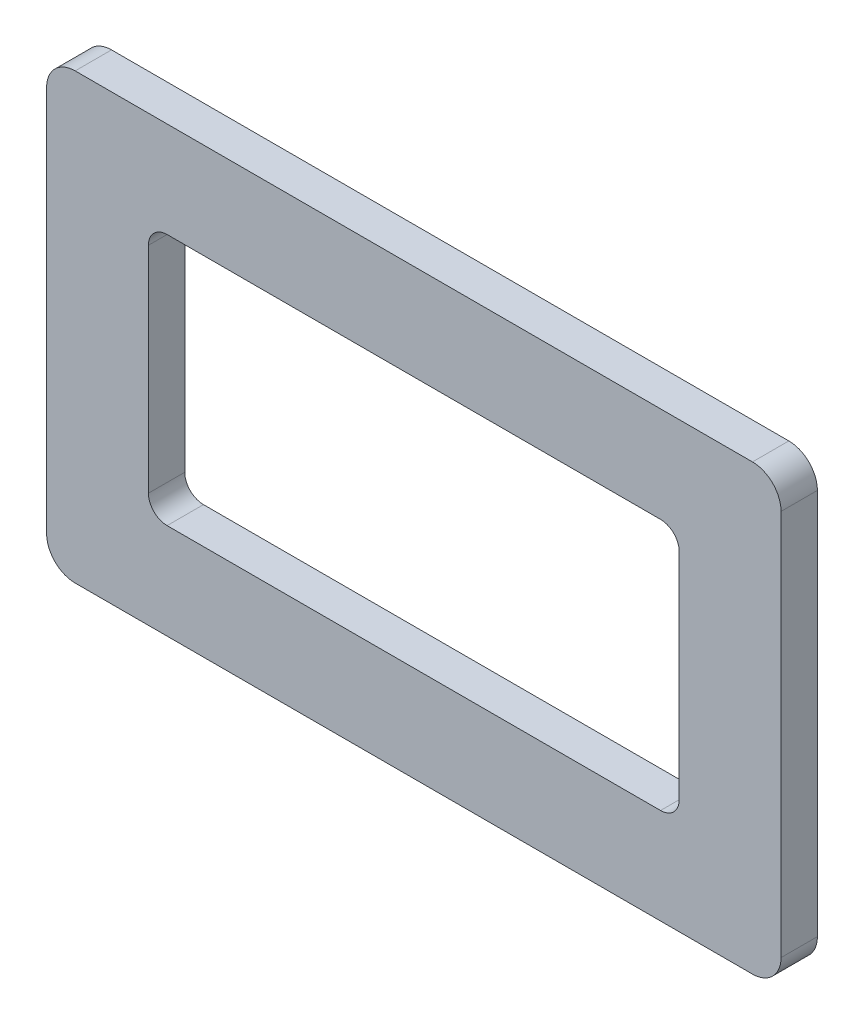
from build123d import *

# Parameters (mm, degrees)
SKETCH1_W           = 70.7
SKETCH1_H           = 42.7
SKETCH1_W_2         = 51.1
SKETCH1_H_2         = 24.268683634
BOSS_EXTRUDE1_DEPTH = 3.5
FILLET1_R           = 2.75
FILLET2_R           = 1.8


with BuildPart() as part:
    # Sketch1 → Boss-Extrude1 (new body)
    with BuildSketch(Plane.XY):
        Rectangle(SKETCH1_W, SKETCH1_H)
        Rectangle(SKETCH1_W_2, SKETCH1_H_2, mode=Mode.SUBTRACT)
    extrude(amount=BOSS_EXTRUDE1_DEPTH)

    # Fillet1
    fillet1_edges = [part.edges().sort_by_distance(p)[0] for p in [
        (35.35, -21.35, 1.75),
        (-35.35, -21.35, 1.75),
        (-35.35, 21.35, 1.75),
        (35.35, 21.35, 1.75),
    ]]
    fillet(fillet1_edges, radius=FILLET1_R)

    # Fillet2
    fillet2_edges = [part.edges().sort_by_distance(p)[0] for p in [
        (25.55, -12.134341817, 1.75),
        (25.55, 12.134341817, 1.75),
        (-25.55, 12.134341817, 1.75),
        (-25.55, -12.134341817, 1.75),
    ]]
    fillet(fillet2_edges, radius=FILLET2_R)


solid = part.part
